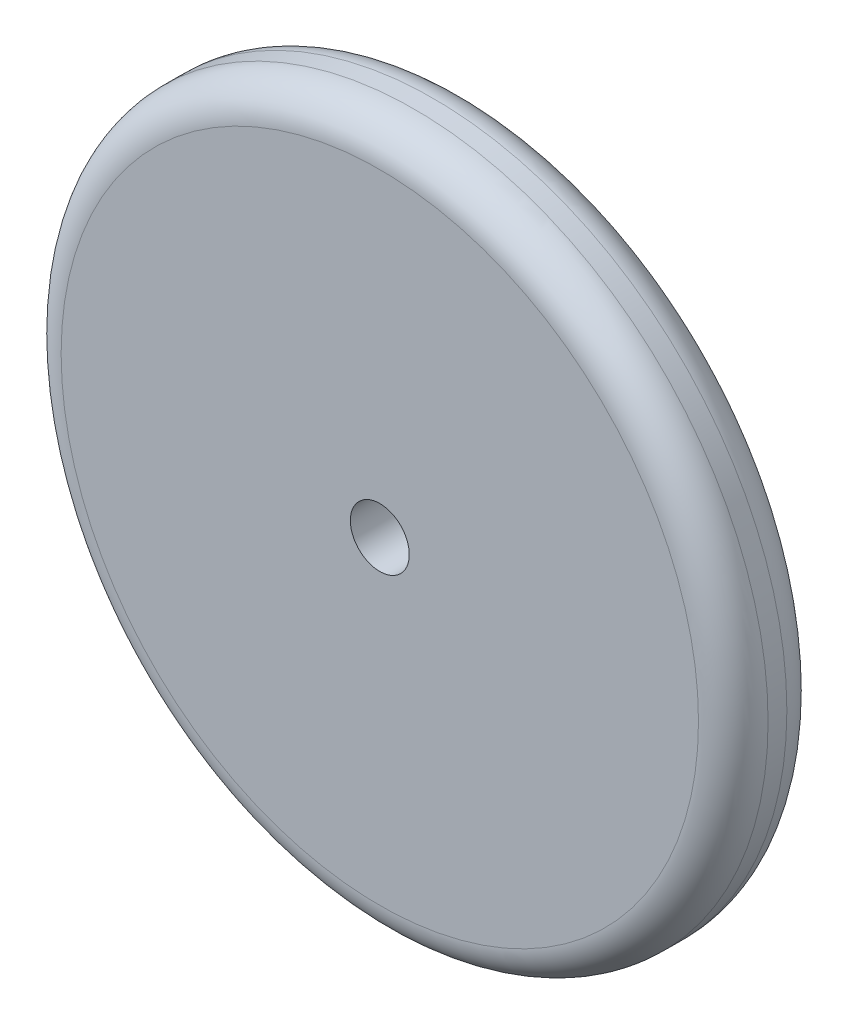
from build123d import *

# Parameters (mm, degrees)
SKETCH1_R           = 152.4
SKETCH1_R_2         = 12.7
BOSS_EXTRUDE1_DEPTH = 38.1
FILLET1_R           = 15


with BuildPart() as part:
    # Sketch1 → Boss-Extrude1 (new body)
    with BuildSketch(Plane.XY):
        with Locations(Location((0, 0, 0), (0, 0, 180))):
            Circle(SKETCH1_R)
        with Locations(Location((0, 0, 0), (0, 0, 180))):
            Circle(SKETCH1_R_2, mode=Mode.SUBTRACT)
    extrude(amount=BOSS_EXTRUDE1_DEPTH)

    # Fillet1
    fillet1_edges = [part.edges().sort_by_distance(p)[0] for p in [
        (152.4, 0, 0),
        (152.4, 0, 38.1),
    ]]
    fillet(fillet1_edges, radius=FILLET1_R)


solid = part.part
